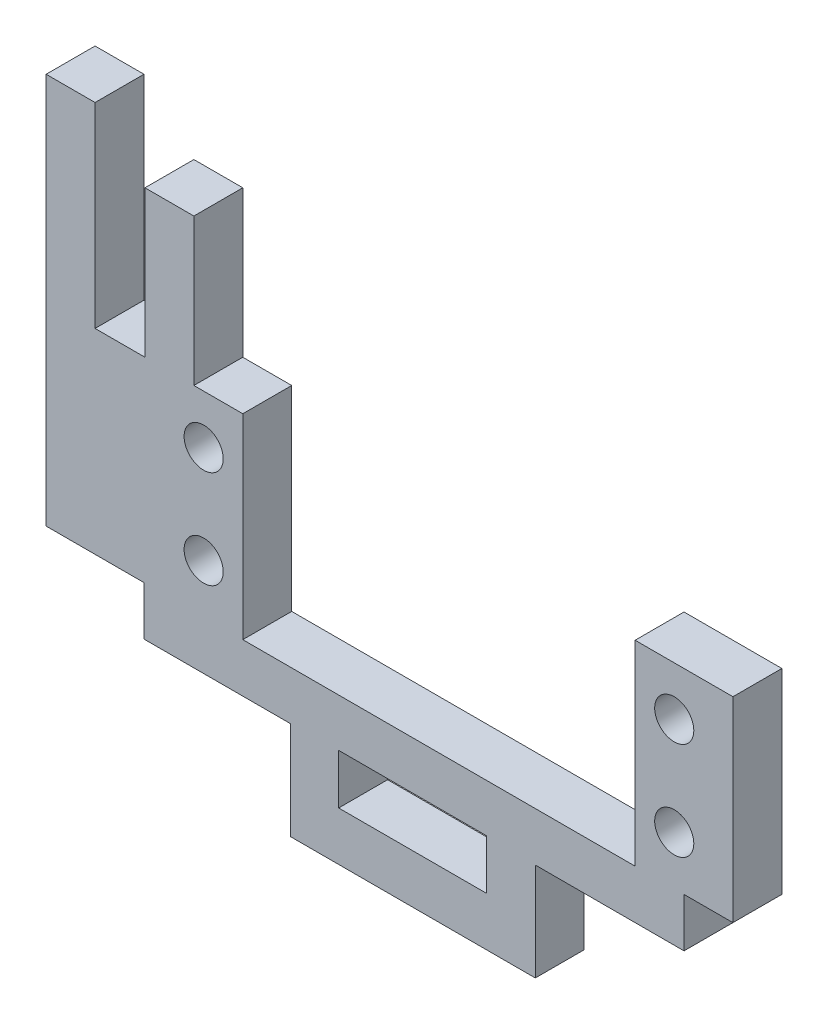
from build123d import *

# Parameters (mm, degrees)
SKETCH1_R           = 2
SKETCH1_W           = 15.1
SKETCH1_H           = 5.1
BOSS_EXTRUDE1_DEPTH = 5


with BuildPart() as part:
    # Sketch1 → Boss-Extrude1 (new body)
    with BuildSketch(Plane.XY):
        Polygon((-70.2, 20), (-65.2, 20), (-65.2, 0), (-60.1, 0), (-60.1, 15), (-55.1, 15), (-55.1, 0), (-50.1, 0), (-50.1, -20), (-10, -20), (-10, 0), (0, 0), (0, -20), (-5, -20), (-5, -25), (-20.2, -25), (-20.2, -35), (-45.2, -35), (-45.2, -25), (-60.2, -25), (-60.2, -20), (-70.2, -20), align=None)
        with Locations((-54.1, -5)):
            Circle(SKETCH1_R, mode=Mode.SUBTRACT)
        with Locations((-54.1, -15)):
            Circle(SKETCH1_R, mode=Mode.SUBTRACT)
        with Locations((-6, -5)):
            Circle(SKETCH1_R, mode=Mode.SUBTRACT)
        with Locations((-6, -15)):
            Circle(SKETCH1_R, mode=Mode.SUBTRACT)
        with Locations((-32.75, -27.45)):
            Rectangle(SKETCH1_W, SKETCH1_H, mode=Mode.SUBTRACT)
    extrude(amount=BOSS_EXTRUDE1_DEPTH)


solid = part.part
